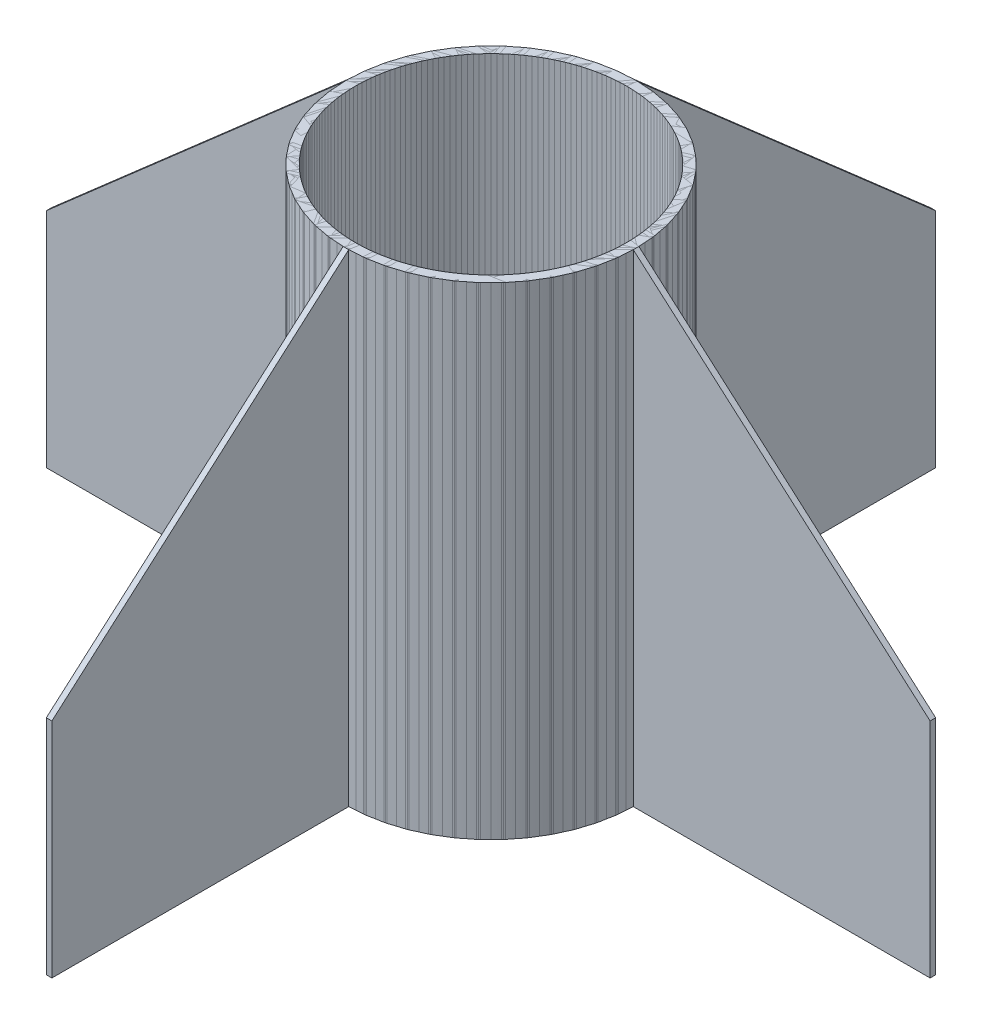
from build123d import *

# Parameters (mm, degrees)
SKETCH1_R                = 78.2
SKETCH1_R_2              = 73.2
BOSS_EXTRUDE1_DEPTH      = 260
BOSS_EXTRUDE2_DEPTH      = 1.5
BOSS_EXTRUDE2_DEPTH_BACK = 1.5
BOSS_EXTRUDE3_DEPTH      = 1.5
BOSS_EXTRUDE3_DEPTH_BACK = 1.5
SKETCH4_W                = 2
SKETCH4_H                = 260
CIRPATTERN1_COUNT        = 4


with BuildPart() as part:
    # Sketch1 → Boss-Extrude1 (new body)
    with BuildSketch(Plane(origin=(0, 0, 0), x_dir=(1, 0, 0), z_dir=(0, 1, 0))):
        Circle(SKETCH1_R)
        Circle(SKETCH1_R_2, mode=Mode.SUBTRACT)
    extrude(amount=BOSS_EXTRUDE1_DEPTH)



with BuildPart() as body_2:
    # Sketch2 → Boss-Extrude2 (new, two sides: drawn at the far end of the back side and taken through both)
    with BuildSketch(Plane.XY.offset(-BOSS_EXTRUDE2_DEPTH_BACK)):
        Polygon((78.2, 0), (78.2, 260), (238.2, 120), (238.2, 0), align=None)
    extrude(amount=BOSS_EXTRUDE2_DEPTH + BOSS_EXTRUDE2_DEPTH_BACK)


with BuildPart() as part_1:
    add(part.part)

    add(body_2.part)  # Boss-Extrude3 merges body 2
    # Sketch4 → Boss-Extrude3 (add, two sides: drawn at the far end of the back side and taken through both)
    with BuildSketch(Plane.XY.offset(-BOSS_EXTRUDE3_DEPTH_BACK)):
        with Locations((77.2, 130)):
            Rectangle(SKETCH4_W, SKETCH4_H)
    extrude(amount=BOSS_EXTRUDE3_DEPTH + BOSS_EXTRUDE3_DEPTH_BACK)


with BuildPart() as cirpattern1_1:
    # CirPattern1: pattern copy
    add(part_1.part.rotate(Axis((0, 260, 0), (0, -1, 0)), 1 * 360 / CIRPATTERN1_COUNT))


with BuildPart() as cirpattern1_2:
    # CirPattern1: pattern copy
    add(part_1.part.rotate(Axis((0, 260, 0), (0, -1, 0)), 2 * 360 / CIRPATTERN1_COUNT))


with BuildPart() as cirpattern1_3:
    # CirPattern1: pattern copy
    add(part_1.part.rotate(Axis((0, 260, 0), (0, -1, 0)), 3 * 360 / CIRPATTERN1_COUNT))


solid = Compound([part_1.part, cirpattern1_1.part, cirpattern1_2.part, cirpattern1_3.part])
